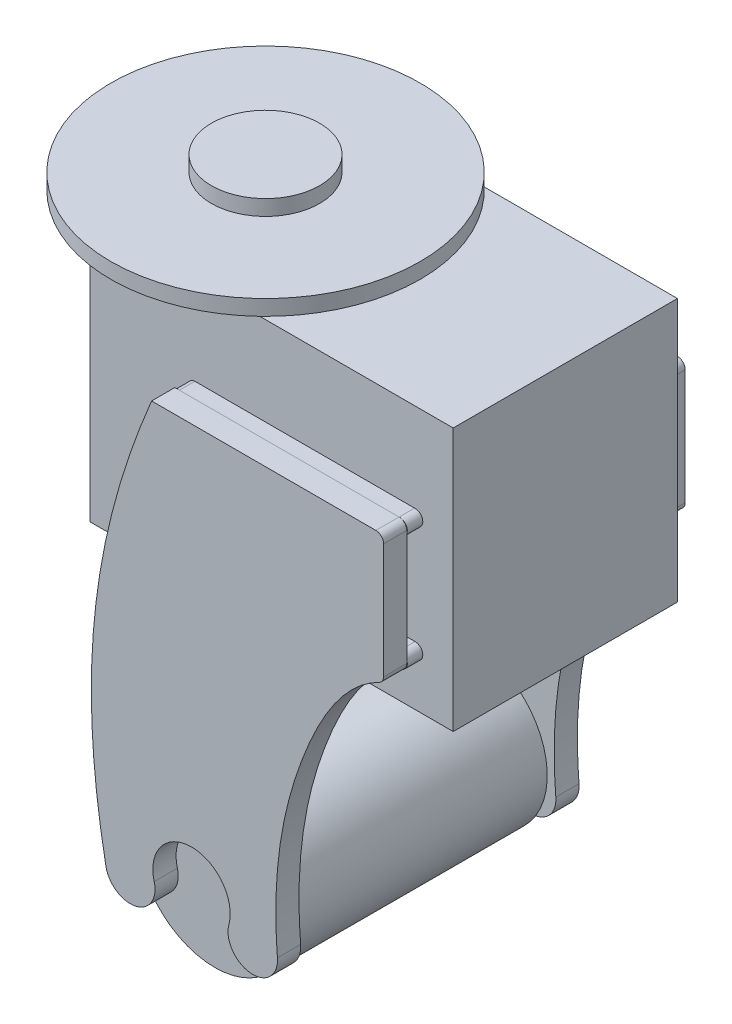
from build123d import *

# Parameters (mm, degrees)
SKETCH1_W           = 47
SKETCH1_H           = 29
BOSS_EXTRUDE1_DEPTH = 34
BOSS_EXTRUDE2_START = 2
BOSS_EXTRUDE2_DEPTH = 3
BOSS_EXTRUDE3_DEPTH = 2
CUT_EXTRUDE1_DEPTH  = 66.273998936
BOSS_EXTRUDE4_START = -3
SKETCH5_R           = 10
BOSS_EXTRUDE4_DEPTH = 33
SKETCH6_R           = 20
BOSS_EXTRUDE5_DEPTH = 2
SKETCH7_R           = 7
BOSS_EXTRUDE6_DEPTH = 2


with BuildPart() as part:
    # Sketch1 → Boss-Extrude1 (new body)
    with BuildSketch(Plane(origin=(0, 0, 0), x_dir=(1, 0, 0), z_dir=(0, 1, 0))):
        Rectangle(SKETCH1_W, SKETCH1_H)
    extrude(amount=-BOSS_EXTRUDE1_DEPTH)

    # Sketch3 → Boss-Extrude3 (add)
    with BuildSketch(Plane(origin=(0, 0, -14.5), x_dir=(-1, 0, 0), z_dir=(0, 0, -1))):
        with BuildLine():
            Line((9.9, -11.474148425), (-18.5, -11.474148425))
            ThreePointArc((-18.5, -11.474148425), (-19.566030524, -12.438617913), (-18.566585497, -13.471929148))
            Line((-18.566585497, -13.471929148), (9.833414503, -13.471929148))
            ThreePointArc((9.833414503, -13.471929148), (10.83285953, -12.505240384), (9.9, -11.474148425))
        make_face()
        with BuildLine():
            Line((-18.566585497, -28.386799147), (9.833414503, -28.386799147))
            ThreePointArc((9.833414503, -28.386799147), (10.833414503, -27.386799147), (9.833414503, -26.386799147))
            Line((9.833414503, -26.386799147), (-18.566585497, -26.386799147))
            ThreePointArc((-18.566585497, -26.386799147), (-19.566585497, -27.386799147), (-18.566585497, -28.386799147))
        make_face()
    boss_extrude3 = extrude(amount=BOSS_EXTRUDE3_DEPTH)

    # Sketch4 → Cut-Extrude1 (cut, through all)
    with BuildSketch(Plane(origin=(0, -11.474148425, 0), x_dir=(1, 0, 0), z_dir=(0, 1, 0))):
        with BuildLine():
            Line((-2.418528857, 15.581579117), (11.618528857, 15.581579117))
            ThreePointArc((11.618528857, 15.581579117), (12.040741284, 15.516396208), (12.423637948, 15.326917211))
            Line((12.423637948, 15.326917211), (13.6, 14.5))
            Line((13.6, 14.5), (-4.4, 14.5))
            Line((-4.4, 14.5), (-3.223637948, 15.326917211))
            ThreePointArc((-3.223637948, 15.326917211), (-2.840741284, 15.516396208), (-2.418528857, 15.581579117))
        make_face()
    extrude(amount=-CUT_EXTRUDE1_DEPTH, mode=Mode.SUBTRACT)

    # Mirror4: Boss-Extrude3 across plane
    add(boss_extrude3.mirror(Plane.XY))

    # Sketch6 → Boss-Extrude5 (add)
    with BuildSketch(Plane(origin=(0, 0, 0), x_dir=(1, 0, 0), z_dir=(0, 1, 0))):
        with Locations(Location((-15.27, 0, 0), (0, 0, 46.468847833))):
            Circle(SKETCH6_R)
    extrude(amount=BOSS_EXTRUDE5_DEPTH)

    # Sketch7 → Boss-Extrude6 (add)
    with BuildSketch(Plane(origin=(0, 2, 0), x_dir=(1, 0, 0), z_dir=(0, 1, 0))):
        with Locations(Location((-15.27, 0, 0), (0, 0, 270))):
            Circle(SKETCH7_R)
    extrude(amount=BOSS_EXTRUDE6_DEPTH)


with BuildPart() as body_2:
    # Sketch2 → Boss-Extrude2 (new body)
    with BuildSketch(Plane(origin=(0, 0, -14.5), x_dir=(-1, 0, 0), z_dir=(0, 0, -1)).offset(BOSS_EXTRUDE2_START)):
        with BuildLine():
            Line((-18.5, -11.474148425), (10.5, -11.474148425))
            add(Edge.make_bspline(
                [(10.5, -11.474148425), (18.34379495, -30.085994321), (20.184872836, -47.014188136), (16.401438499, -66.572414203)],
                knots=[0, 0, 0, 0, 1, 1, 1, 1], degree=3))
            ThreePointArc((16.401438499, -66.572414203), (12.541115786, -69.082936974), (10.168788044, -65.136181709))
            ThreePointArc((10.168788044, -65.136181709), (5.339265933, -58.841687144), (0.509743822, -65.136181709))
            ThreePointArc((0.509743822, -65.136181709), (-2.292431696, -69.151606858), (-5.770609942, -65.70514449))
            add(Edge.make_bspline(
                [(-18.942985728, -28.265754136), (-14.351246375, -30.534588452), (-6.816589683, -43.814775737), (-5.064114447, -57.022217569), (-5.770609942, -65.70514449)],
                knots=[0.029970627, 0.029970627, 0.029970627, 0.029970627, 0.417815731, 1, 1, 1, 1], degree=3))
            ThreePointArc((-18.942985728, -28.265754136), (-19.34940736, -27.896963225), (-19.5, -27.369225472))
            Line((-19.5, -27.369225472), (-19.5, -12.474148425))
            ThreePointArc((-19.5, -12.474148425), (-19.207106781, -11.767041644), (-18.5, -11.474148425))
        make_face()
    extrude(amount=BOSS_EXTRUDE2_DEPTH)


with BuildPart() as body_3:
    # Mirror5: mirrored copy
    add(body_2.part.mirror(Plane.XY))


with BuildPart() as body_4:
    # Sketch5 → Boss-Extrude4 (new body)
    with BuildSketch(Plane(origin=(0, 0, -19.5), x_dir=(-1, 0, 0), z_dir=(0, 0, -1)).offset(BOSS_EXTRUDE4_START)):
        with Locations((5.339265933, -63.841687144)):
            Circle(SKETCH5_R)
    extrude(amount=-BOSS_EXTRUDE4_DEPTH)


solid = Compound([part.part, body_2.part, body_3.part, body_4.part])
